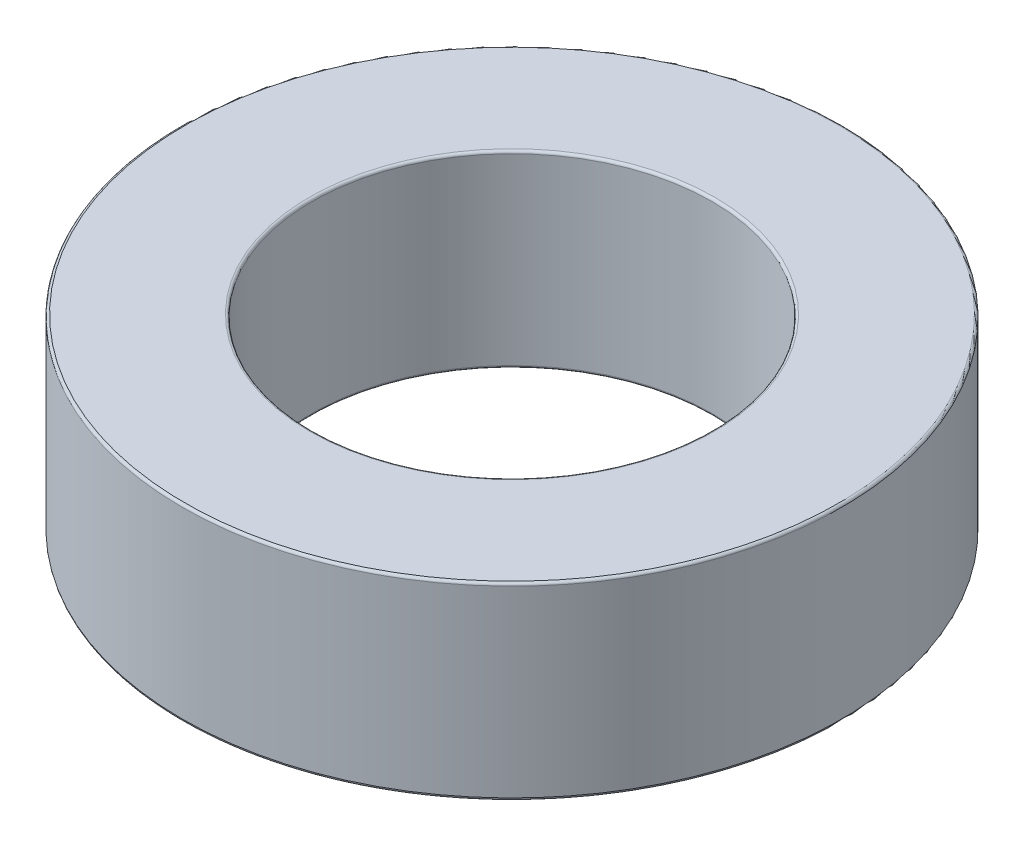
from build123d import *


with BuildPart() as part:
    # Toroidal Core → Revolve2 (revolve)
    with BuildSketch(Plane.XY, mode=Mode.PRIVATE) as revolve2_sk:
        with BuildLine():
            Line((11.59739394, 0), (18.713632535, 0))
            ThreePointArc((18.713632535, 0), (18.816911461, 0.042779532), (18.859690994, 0.146058459))
            Line((18.859690994, 0.146058459), (18.859690994, 10.640147279))
            ThreePointArc((18.859690994, 10.640147279), (18.816911461, 10.743426205), (18.713632535, 10.786205737))
            Line((18.713632535, 10.786205737), (11.59739394, 10.786205737))
            ThreePointArc((11.59739394, 10.786205737), (11.494115013, 10.743426205), (11.451335481, 10.640147279))
            Line((11.451335481, 10.640147279), (11.451335481, 0.146058459))
            ThreePointArc((11.451335481, 0.146058459), (11.494115013, 0.042779532), (11.59739394, 0))
        make_face()
    revolve(revolve2_sk.sketch.rotate(Axis((0, -8.107972275, 0), (0, 1, 0)), 90), axis=Axis((0, -8.107972275, 0), (0, 1, 0)))


solid = part.part
